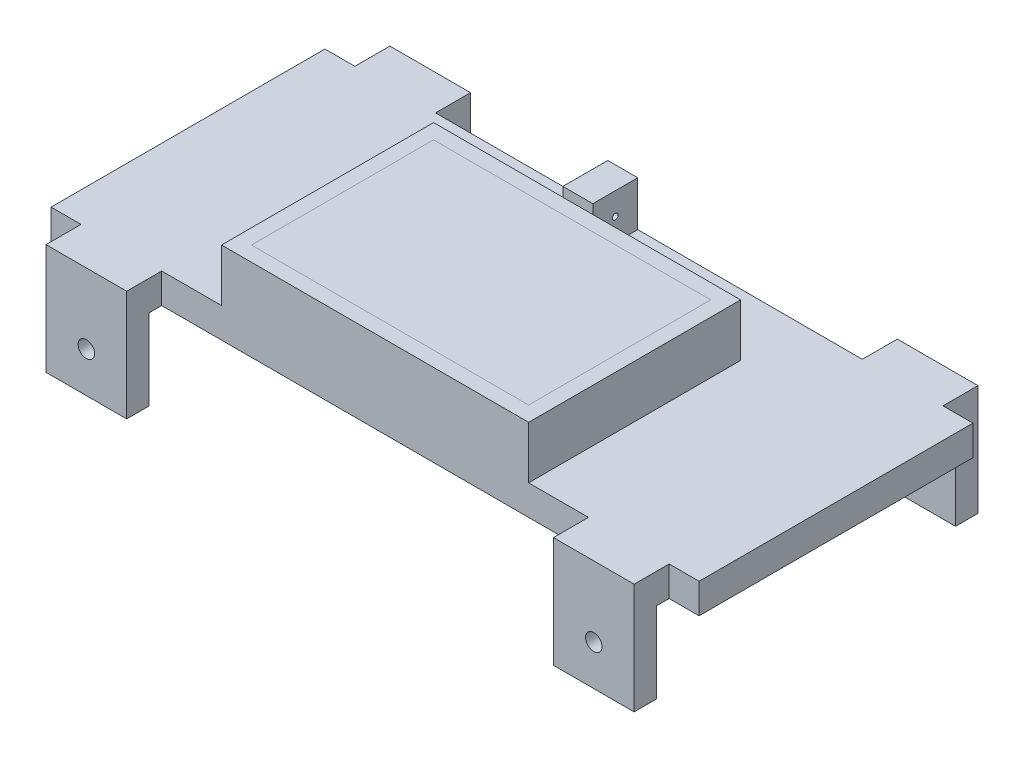
from build123d import *

# Parameters (mm, degrees)
SKETCH1_W               = 36.575
SKETCH1_H               = 41.655
SKETCH1_W_2             = 28.575
SKETCH1_H_2             = 33.655
BOSS_EXTRUDE1_DEPTH     = 41.275
SKETCH2_W               = 36.575
SKETCH2_H               = 41.655
BOSS_EXTRUDE2_DEPTH     = 2
SKETCH4_W               = 86.55
SKETCH4_H               = 36.575
CUT_EXTRUDE2_DEPTH      = 37.655
SKETCH5_W               = 10.7752
SKETCH5_H               = 4
BOSS_EXTRUDE3_DEPTH     = 1.6764
SKETCH6_W               = 10.7752
SKETCH6_H               = 14.7752
SKETCH6_R               = 1.1
BOSS_EXTRUDE4_DEPTH     = 3
MIRROR3_COPY_1_SKETCH_W = 10.7752
MIRROR3_COPY_1_SKETCH_H = 4
MIRROR3_COPY_1_DEPTH    = 1.6764
MIRROR3_COPY_2_SKETCH_W = 10.7752
MIRROR3_COPY_2_SKETCH_H = 14.7752
MIRROR3_COPY_2_SKETCH_R = 1.1
MIRROR3_COPY_2_DEPTH    = 3
SKETCH7_W               = 4
SKETCH7_H               = 6
BOSS_EXTRUDE5_DEPTH     = 6
SKETCH8_R               = 0.381
CUT_EXTRUDE3_DEPTH      = 58.021122047
SKETCH9_W               = 41.02
SKETCH9_H               = 28.32
SKETCH9_W_2             = 33.02
SKETCH9_H_2             = 20.32
BOSS_EXTRUDE6_DEPTH     = 3
SKETCH10_W              = 41.02
SKETCH10_H              = 28.32
SKETCH10_W_2            = 37.02
SKETCH10_H_2            = 24.32
BOSS_EXTRUDE7_DEPTH     = 4
SKETCH11_W              = 37.02
SKETCH11_H              = 24.32
BOSS_EXTRUDE8_DEPTH     = 4


with BuildPart() as part:
    # Sketch1 → Boss-Extrude1 (new, symmetric)
    with BuildSketch(Plane(origin=(0, 0, 0), x_dir=(0, 0, -1), z_dir=(1, 0, 0))):
        Rectangle(SKETCH1_W, SKETCH1_H)
        Rectangle(SKETCH1_W_2, SKETCH1_H_2, mode=Mode.SUBTRACT)
    extrude(amount=BOSS_EXTRUDE1_DEPTH, both=True)

    # Sketch2 → Boss-Extrude2 (add)
    with BuildSketch(Plane.ZY.offset(41.275)):
        Rectangle(SKETCH2_W, SKETCH2_H)
    boss_extrude2 = extrude(amount=BOSS_EXTRUDE2_DEPTH)

    # Mirror1: Boss-Extrude2 across plane
    add(boss_extrude2.mirror(Plane(origin=(0, 0, 0), x_dir=(0, 0, 1), z_dir=(1, 0, 0))))

    # Sketch4 → Cut-Extrude2 (cut)
    with BuildSketch(Plane.XZ.offset(20.8275)):
        Rectangle(SKETCH4_W, SKETCH4_H)
    extrude(amount=-CUT_EXTRUDE2_DEPTH, mode=Mode.SUBTRACT)

    # Sketch5 → Boss-Extrude3 (add)
    with BuildSketch(Plane(origin=(0, 0, -18.2875), x_dir=(-1, 0, 0), z_dir=(0, 0, -1))):
        with Locations((-33.8874, 18.8275)):
            Rectangle(SKETCH5_W, SKETCH5_H)
    boss_extrude3 = extrude(amount=BOSS_EXTRUDE3_DEPTH)

    # Sketch6 → Boss-Extrude4 (add)
    with BuildSketch(Plane(origin=(0, 0, -19.9639), x_dir=(-1, 0, 0), z_dir=(0, 0, -1))):
        with Locations((-33.8874, 13.4399)):
            Rectangle(SKETCH6_W, SKETCH6_H)
        with Locations((-33.8874, 11.4399)):
            Circle(SKETCH6_R, mode=Mode.SUBTRACT)
    boss_extrude4 = extrude(amount=BOSS_EXTRUDE4_DEPTH)

    # Mirror2: Boss-Extrude3, Boss-Extrude4 across plane
    add(boss_extrude3.mirror(Plane(origin=(0, 0, 0), x_dir=(0, 0, 1), z_dir=(1, 0, 0))))
    add(boss_extrude4.mirror(Plane(origin=(0, 0, 0), x_dir=(0, 0, 1), z_dir=(1, 0, 0))))

    # Mirror3: Boss-Extrude3, Boss-Extrude4 across plane
    add(boss_extrude3.mirror(Plane.XY))
    add(boss_extrude4.mirror(Plane.XY))

    # Mirror3 copy 1 sketch → Mirror3 copy 1 (add)
    with BuildSketch(Plane.XY.offset(18.2875)):
        with Locations((-33.8874, 18.8275)):
            Rectangle(MIRROR3_COPY_1_SKETCH_W, MIRROR3_COPY_1_SKETCH_H)
    extrude(amount=MIRROR3_COPY_1_DEPTH)

    # Mirror3 copy 2 sketch → Mirror3 copy 2 (add)
    with BuildSketch(Plane.XY.offset(19.9639)):
        with Locations((-33.8874, 13.4399)):
            Rectangle(MIRROR3_COPY_2_SKETCH_W, MIRROR3_COPY_2_SKETCH_H)
        with Locations((-33.8874, 11.4399)):
            Circle(MIRROR3_COPY_2_SKETCH_R, mode=Mode.SUBTRACT)
    extrude(amount=MIRROR3_COPY_2_DEPTH)

    # Sketch7 → Boss-Extrude5 (add)
    with BuildSketch(Plane(origin=(0, 20.8275, 0), x_dir=(1, 0, 0), z_dir=(0, 1, 0))):
        with Locations((-3.495, 15.2875)):
            Rectangle(SKETCH7_W, SKETCH7_H)
    extrude(amount=BOSS_EXTRUDE5_DEPTH)

    # Sketch8 → Cut-Extrude3 (cut, through all)
    with BuildSketch(Plane(origin=(-1.495, 0, 0), x_dir=(0, 0, -1), z_dir=(1, 0, 0))):
        with Locations((15.2875, 23.8275)):
            Circle(SKETCH8_R)
    extrude(amount=-CUT_EXTRUDE3_DEPTH, mode=Mode.SUBTRACT)

    # Sketch9 → Boss-Extrude6 (add)
    with BuildSketch(Plane(origin=(0, 20.8275, 0), x_dir=(1, 0, 0), z_dir=(0, 1, 0))):
        with Locations((0, -4.1275)):
            Rectangle(SKETCH9_W, SKETCH9_H)
        with Locations((0, -4.1275)):
            Rectangle(SKETCH9_W_2, SKETCH9_H_2, mode=Mode.SUBTRACT)
    extrude(amount=BOSS_EXTRUDE6_DEPTH)

    # Sketch10 → Boss-Extrude7 (add)
    with BuildSketch(Plane(origin=(0, 23.8275, 0), x_dir=(1, 0, 0), z_dir=(0, 1, 0))):
        with Locations((0, -4.1275)):
            Rectangle(SKETCH10_W, SKETCH10_H)
        with Locations((0, -4.1275)):
            Rectangle(SKETCH10_W_2, SKETCH10_H_2, mode=Mode.SUBTRACT)
    extrude(amount=BOSS_EXTRUDE7_DEPTH)


with BuildPart() as body_2:
    # Sketch11 → Boss-Extrude8 (new body)
    with BuildSketch(Plane(origin=(0, 23.8275, 0), x_dir=(1, 0, 0), z_dir=(0, 1, 0))):
        with Locations((0, -4.1275)):
            Rectangle(SKETCH11_W, SKETCH11_H)
    extrude(amount=BOSS_EXTRUDE8_DEPTH)


solid = Compound([part.part, body_2.part])
